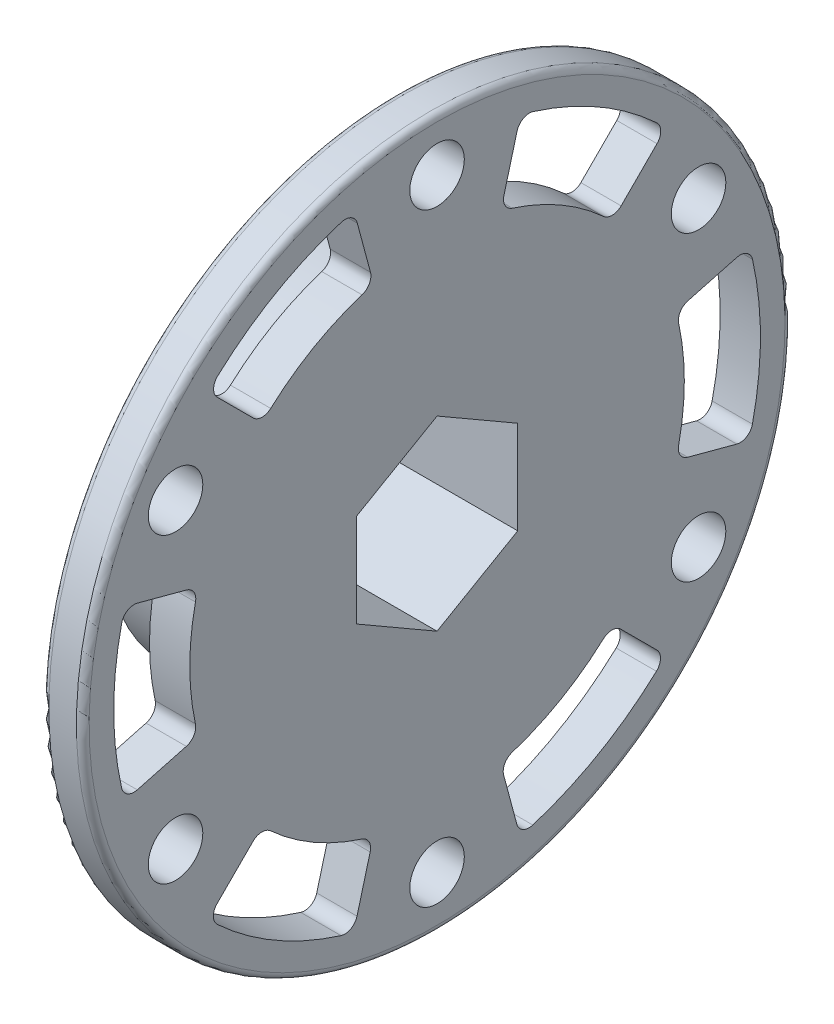
from build123d import *

# Parameters (mm, degrees)
SKETCH1_W                 = 3.175
SKETCH1_H                 = 27.94
CUT_EXTRUDE1_DEPTH        = 40.640482149
CUT_EXTRUDE2_DEPTH        = 40.640482149
CUT_EXTRUDE3_DEPTH        = 40.640482149
CUT_EXTRUDE4_DEPTH        = 40.640482149
CUT_EXTRUDE5_DEPTH        = 40.640482149
CUT_EXTRUDE6_DEPTH        = 40.640482149
SKETCH8_R                 = 14.294919975
BOSS_EXTRUDE1_DEPTH       = 9.525
CUT_EXTRUDE7_DEPTH        = 42.503941981
F_6_CLEARANCE_HOLE1_D     = 4.3
F_6_CLEARANCE_HOLE1_DEPTH = 12.7
CHAMFER1_SIZE             = 1
FILLET1_R                 = 0.5
FILLET2_R                 = 1
FILLET3_R                 = 1.27


with BuildPart() as part:
    # Sketch1 → Revolve1 (revolve)
    with BuildSketch(Plane(origin=(0, 0, 0), x_dir=(-1, 0, 0), z_dir=(0, 0, -1)), mode=Mode.PRIVATE) as revolve1_sk:
        with Locations((-11.1125, 13.97)):
            Rectangle(SKETCH1_W, SKETCH1_H)
    revolve(revolve1_sk.sketch.rotate(Axis((12.7, 0, 0), (-1, 0, 0)), 180), axis=Axis((12.7, 0, 0), (-1, 0, 0)))

    # Sketch2 → Cut-Extrude1 (cut, through all)
    with BuildSketch(Plane.ZY.offset(-9.525)):
        with BuildLine():
            Line((-13.806531048, -13.770610024), (-18.049174487, -18.013253463))
            ThreePointArc((-18.049174487, -18.013253463), (-12.738999884, -22.089995065), (-6.550803522, -24.644207701))
            Line((-6.550803522, -24.644207701), (-4.997885221, -18.848637704))
            ThreePointArc((-4.997885221, -18.848637704), (-9.738999389, -16.893841804), (-13.806531048, -13.770610024))
        make_face()
    extrude(amount=-CUT_EXTRUDE1_DEPTH, mode=Mode.SUBTRACT)

    # Sketch3 → Cut-Extrude2 (cut, through all)
    with BuildSketch(Plane.ZY.offset(-9.525)):
        with BuildLine():
            Line((5.022432582, -18.842111637), (6.57534786, -24.637670355))
            ThreePointArc((6.57534786, -24.637670355), (12.760996954, -22.077295051), (18.067108165, -17.995266116))
            Line((18.067108165, -17.995266116), (13.824456468, -13.752614419))
            ThreePointArc((13.824456468, -13.752614419), (9.760996476, -16.88114178), (5.022432582, -18.842111637))
        make_face()
    extrude(amount=-CUT_EXTRUDE2_DEPTH, mode=Mode.SUBTRACT)

    # Sketch4 → Cut-Extrude3 (cut, through all)
    with BuildSketch(Plane.ZY.offset(-9.525)):
        with BuildLine():
            Line((18.82896363, -5.071501614), (24.624522347, -6.624416892))
            ThreePointArc((24.624522347, -6.624416892), (25.499996837, 0.012700014), (24.617911686, 6.648941586))
            Line((24.617911686, 6.648941586), (18.822341689, 5.096023285))
            ThreePointArc((18.822341689, 5.096023285), (19.499995864, 0.012700024), (18.82896363, -5.071501614))
        make_face()
    extrude(amount=-CUT_EXTRUDE3_DEPTH, mode=Mode.SUBTRACT)

    # Sketch5 → Cut-Extrude4 (cut, through all)
    with BuildSketch(Plane.ZY.offset(-9.525)):
        with BuildLine():
            Line((13.806531048, 13.770610024), (18.049174487, 18.013253463))
            ThreePointArc((18.049174487, 18.013253463), (12.738999884, 22.089995065), (6.550803522, 24.644207701))
            Line((6.550803522, 24.644207701), (4.997885221, 18.848637704))
            ThreePointArc((4.997885221, 18.848637704), (9.738999389, 16.893841804), (13.806531048, 13.770610024))
        make_face()
    extrude(amount=-CUT_EXTRUDE4_DEPTH, mode=Mode.SUBTRACT)

    # Sketch6 → Cut-Extrude5 (cut, through all)
    with BuildSketch(Plane.ZY.offset(-9.525)):
        with BuildLine():
            Line((-24.617911686, -6.648941586), (-18.822341689, -5.096023285))
            ThreePointArc((-18.822341689, -5.096023285), (-19.499995864, -0.012700024), (-18.82896363, 5.071501614))
            Line((-18.82896363, 5.071501614), (-24.624522347, 6.624416892))
            ThreePointArc((-24.624522347, 6.624416892), (-25.499996837, -0.012700014), (-24.617911686, -6.648941586))
        make_face()
    extrude(amount=-CUT_EXTRUDE5_DEPTH, mode=Mode.SUBTRACT)

    # Sketch7 → Cut-Extrude6 (cut, through all)
    with BuildSketch(Plane(origin=(12.7, 0, 0), x_dir=(0, 0, -1), z_dir=(1, 0, 0))):
        with BuildLine():
            Line((6.57534786, 24.637670355), (5.022432582, 18.842111637))
            ThreePointArc((5.022432582, 18.842111637), (9.760996476, 16.88114178), (13.824456468, 13.752614419))
            Line((13.824456468, 13.752614419), (18.067108165, 17.995266116))
            ThreePointArc((18.067108165, 17.995266116), (12.760996954, 22.077295051), (6.57534786, 24.637670355))
        make_face()
    extrude(amount=-CUT_EXTRUDE6_DEPTH, mode=Mode.SUBTRACT)

    # Sketch8 → Boss-Extrude1 (add)
    with BuildSketch(Plane.ZY.offset(-9.525)):
        with Locations(Location((0, 0, 0), (0, 0, 270))):
            Circle(SKETCH8_R)
    extrude(amount=BOSS_EXTRUDE1_DEPTH)

    # Sketch9 → Cut-Extrude7 (cut, through all)
    with BuildSketch(Plane(origin=(12.7, 0, 0), x_dir=(0, 0, -1), z_dir=(1, 0, 0))):
        Polygon((-6.3627, 3.673506558), (-6.3627, -3.673506558), (0, -7.347013116), (6.3627, -3.673506558), (6.3627, 3.673506558), (0, 7.347013116), align=None)
    extrude(amount=-CUT_EXTRUDE7_DEPTH, mode=Mode.SUBTRACT)

    # #6 Clearance Hole1
    with Locations(Plane(origin=(12.7, 0, 0), x_dir=(0, 0, -1), z_dir=(1, 0, 0))):
        with Locations((20.622229928, 11.90625), (20.622229928, -11.90625), (0, -23.8125), (-20.622229928, -11.90625), (-20.622229928, 11.90625), (0, 23.8125)):
            Hole(F_6_CLEARANCE_HOLE1_D / 2, depth=F_6_CLEARANCE_HOLE1_DEPTH)

    # Chamfer1
    chamfer1_edges = [part.edges().sort_by_distance(p)[0] for p in [
        (0, 14.294919975, 0),
    ]]
    chamfer(chamfer1_edges, length=CHAMFER1_SIZE)

    # Fillet1
    fillet1_edges = [part.edges().sort_by_distance(p)[0] for p in [
        (9.525, 27.94, 0),
        (12.7, 27.94, 0),
    ]]
    fillet(fillet1_edges, radius=FILLET1_R)

    # Fillet2
    fillet2_edges = [part.edges().sort_by_distance(p)[0] for p in [
        (11.1125, -13.770610024, -13.806531048),
        (11.1125, -18.848637704, -4.997885221),
        (11.1125, -24.644207701, -6.550803522),
        (11.1125, -18.013253463, -18.049174487),
        (11.1125, -18.842111637, 5.022432582),
        (11.1125, -13.752614419, 13.824456468),
        (11.1125, -17.995266116, 18.067108165),
        (11.1125, -24.637670355, 6.57534786),
        (11.1125, -5.071501614, 18.82896363),
        (11.1125, 5.096023285, 18.822341689),
        (11.1125, 6.648941586, 24.617911686),
        (11.1125, -6.624416892, 24.624522347),
        (11.1125, 13.770610024, 13.806531048),
        (11.1125, 18.848637704, 4.997885221),
        (11.1125, 24.644207701, 6.550803522),
        (11.1125, 18.013253463, 18.049174487),
        (11.1125, -6.648941586, -24.617911686),
        (11.1125, 6.624416892, -24.624522347),
        (11.1125, 5.071501614, -18.82896363),
        (11.1125, -5.096023285, -18.822341689),
        (11.1125, 24.637670355, -6.57534786),
        (11.1125, 17.995266116, -18.067108165),
        (11.1125, 13.752614419, -13.824456468),
        (11.1125, 18.842111637, -5.022432582),
    ]]
    fillet(fillet2_edges, radius=FILLET2_R)

    # Fillet3
    fillet3_edges = [part.edges().sort_by_distance(p)[0] for p in [
        (9.525, 14.294919975, 0),
    ]]
    fillet(fillet3_edges, radius=FILLET3_R)


solid = part.part
